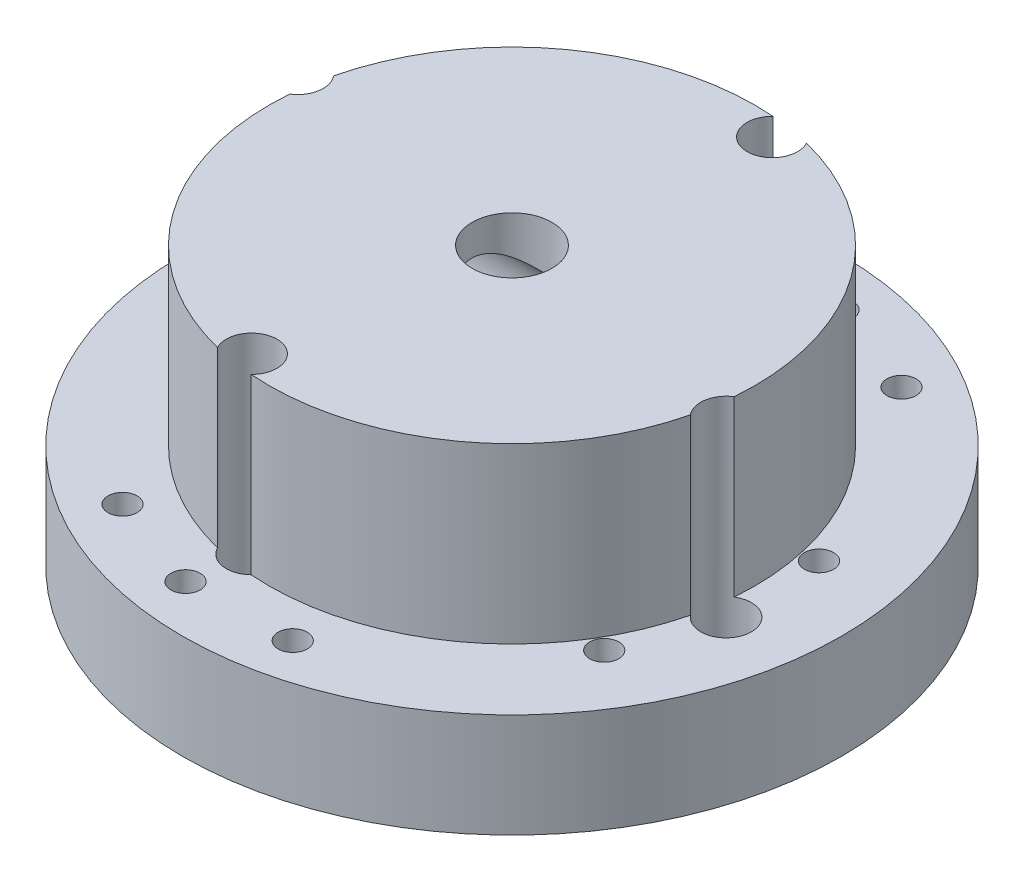
from build123d import *

# Parameters (mm, degrees)
SKETCH1_R                                         = 12.065
BOSS_EXTRUDE1_DEPTH                               = 3.81
SKETCH2_R                                         = 2.54
CUT_EXTRUDE1_DEPTH                                = 10.16
SKETCH3_R                                         = 6.35
BOSS_EXTRUDE2_DEPTH                               = 1.27
SKETCH5_R                                         = 6.35
BOSS_EXTRUDE3_DEPTH                               = 5.08
F_4_CLEARANCE_HOLE1_D                             = 2.921
F_4_CLEARANCE_HOLE1_DEPTH                         = 7.504443066
F_4_CLEARANCE_HOLE1_TIP                           = 0.877556934
BOSS_EXTRUDE4_START                               = -6.35
SKETCH11_W                                        = 12.7
SKETCH11_H                                        = 12.7
SKETCH11_R                                        = 1.4605
BOSS_EXTRUDE4_DEPTH                               = 6.35
SKETCH18_OUTSIDE_W                                = 33.252
SKETCH18_OUTSIDE_H                                = 33.252
SKETCH18_OUTSIDE_R                                = 6.35
CUT_EXTRUDE5_DEPTH                                = 6.35
SKETCH28_R                                        = 8.89
SKETCH28_R_2                                      = 6.35
BOSS_EXTRUDE5_DEPTH                               = 6.35
SKETCH27_W                                        = 2.0447
SKETCH27_H                                        = 12.065
SKETCH29_R                                        = 0.5334
CUT_EXTRUDE6_DEPTH                                = 3.81
BOSS_EXTRUDE6_START                               = 1.524
SKETCH30_R                                        = 2.54
SKETCH30_R_2                                      = 1.4605
BOSS_EXTRUDE6_DEPTH                               = 1.524
BOSS_EXTRUDE7_START                               = 1.27
SKETCH31_R                                        = 2.54
BOSS_EXTRUDE7_DEPTH                               = 1.27
SKETCH32_R                                        = 0.9144
CUT_EXTRUDE7_DEPTH                                = 20.85834968
SKETCH33_R                                        = 2.75
SKETCH33_R_2                                      = 2.54
CUT_EXTRUDE8_DEPTH                                = 1.016
CSK_FOR_0_FLAT_HEAD_MACHINE_SCREW_100_D           = 1.8542
CSK_FOR_0_FLAT_HEAD_MACHINE_SCREW_100_CSINK_D     = 3.0226
CSK_FOR_0_FLAT_HEAD_MACHINE_SCREW_100_CSINK_ANGLE = 100


with BuildPart() as part:
    # Sketch1 → Boss-Extrude1 (new body)
    with BuildSketch(Plane(origin=(0, 0, 0), x_dir=(1, 0, 0), z_dir=(0, 1, 0))):
        with Locations(Location((0, 0, 0), (0, 0, 90))):
            Circle(SKETCH1_R)
    extrude(amount=BOSS_EXTRUDE1_DEPTH)

    # Sketch2 → Cut-Extrude1 (cut)
    with BuildSketch(Plane(origin=(0, 0, 0), x_dir=(1, 0, 0), z_dir=(0, 1, 0))):
        with Locations(Location((0, 0, 0), (0, 0, 270))):
            Circle(SKETCH2_R)
    extrude(amount=CUT_EXTRUDE1_DEPTH, mode=Mode.SUBTRACT)

    # Sketch3 → Boss-Extrude2 (add)
    with BuildSketch(Plane(origin=(0, 3.81, 0), x_dir=(1, 0, 0), z_dir=(0, 1, 0))):
        with Locations(Location((0, 0, 0), (0, 0, 270))):
            Circle(SKETCH3_R)
    extrude(amount=BOSS_EXTRUDE2_DEPTH)

    # Sketch5 → Boss-Extrude3 (add)
    with BuildSketch(Plane(origin=(0, 5.08, 0), x_dir=(1, 0, 0), z_dir=(0, 1, 0))):
        with Locations(Location((0, 0, 0), (0, 0, 270))):
            Circle(SKETCH5_R)
    extrude(amount=BOSS_EXTRUDE3_DEPTH)

    # #4 Clearance Hole1
    with Locations(Plane(origin=(0, 10.16, 0), x_dir=(1, 0, 0), z_dir=(0, 1, 0))):
        with Locations((0, 0)):
            Hole(F_4_CLEARANCE_HOLE1_D / 2, depth=F_4_CLEARANCE_HOLE1_DEPTH)
            with Locations((0, 0, -(F_4_CLEARANCE_HOLE1_DEPTH + F_4_CLEARANCE_HOLE1_TIP / 2))):  # 118° drill point
                Cone(0, F_4_CLEARANCE_HOLE1_D / 2, F_4_CLEARANCE_HOLE1_TIP, mode=Mode.SUBTRACT)

    # Sketch11 → Boss-Extrude4 (add)
    with BuildSketch(Plane(origin=(0, 10.16, 0), x_dir=(1, 0, 0), z_dir=(0, 1, 0)).offset(BOSS_EXTRUDE4_START)):
        Rectangle(SKETCH11_W, SKETCH11_H)
        with Locations(Location((0, 0, 0), (0, 0, 270))):
            Circle(SKETCH11_R, mode=Mode.SUBTRACT)
    extrude(amount=BOSS_EXTRUDE4_DEPTH)

    # Sketch18 outside → Cut-Extrude5 (cut)
    with BuildSketch(Plane(origin=(0, 10.16, 0), x_dir=(1, 0, 0), z_dir=(0, 1, 0))):
        Rectangle(SKETCH18_OUTSIDE_W, SKETCH18_OUTSIDE_H)
        with Locations(Location((0, 0, 0), (0, 0, 270))):
            Circle(SKETCH18_OUTSIDE_R, mode=Mode.SUBTRACT)
    extrude(amount=-CUT_EXTRUDE5_DEPTH, mode=Mode.SUBTRACT)

    # Sketch28 → Boss-Extrude5 (add)
    with BuildSketch(Plane(origin=(0, 10.16, 0), x_dir=(1, 0, 0), z_dir=(0, 1, 0))):
        with Locations(Location((0, 0, 0), (0, 0, 270))):
            Circle(SKETCH28_R)
        Circle(SKETCH28_R_2, mode=Mode.SUBTRACT)
    extrude(amount=-BOSS_EXTRUDE5_DEPTH)

    # Sketch27 → #20 (0.161) Diameter Hole3 (revolve, cut)
    with BuildSketch(Plane(origin=(0, 6.985, 0), x_dir=(0, 0, -1), z_dir=(0, 1, 0))):
        with Locations((1.02235, 6.0325)):
            Rectangle(SKETCH27_W, SKETCH27_H)
    revolve(axis=Axis((6.35, 6.985, 0), (-1, 0, 0)), mode=Mode.SUBTRACT)

    # Sketch29 → Cut-Extrude6 (cut)
    with BuildSketch(Plane.XZ):
        with Locations(Location((9.267757815, -1.967010608, 0), (0, 0, 270))):
            Circle(SKETCH29_R)
        with Locations(Location((9.351926113, 1.517215745, 0), (0, 0, 270))):
            Circle(SKETCH29_R)
        with Locations(Location((8.170536407, 4.796123482, 0), (0, 0, 270))):
            Circle(SKETCH29_R)
        with Locations(Location((1.724727668, 8.124754034, 0), (0, 0, 270))):
            Circle(SKETCH29_R)
        with Locations(Location((2.162502581, 10.187000471, 0), (0, 0, 270))):
            Circle(SKETCH29_R)
        with Locations(Location((-1.667717039, 10.279597068, 0), (0, 0, 270))):
            Circle(SKETCH29_R)
        with Locations(Location((-1.330106029, 8.198605466, 0), (0, 0, 270))):
            Circle(SKETCH29_R)
        with Locations(Location((-5.27220716, 8.980825556, 0), (0, 0, 270))):
            Circle(SKETCH29_R)
        with Locations(Location((-4.204906686, 7.162755992, 0), (0, 0, 270))):
            Circle(SKETCH29_R)
        with Locations(Location((-8.170536407, -4.796123482, 0), (0, 0, 270))):
            Circle(SKETCH29_R)
        with Locations(Location((-9.351926113, -1.517215745, 0), (0, 0, 270))):
            Circle(SKETCH29_R)
        with Locations(Location((-9.267757815, 1.967010608, 0), (0, 0, 270))):
            Circle(SKETCH29_R)
        with Locations(Location((5.272207159, -8.980825556, 0), (0, 0, 270))):
            Circle(SKETCH29_R)
        with Locations(Location((4.204906686, -7.162755992, 0), (0, 0, 270))):
            Circle(SKETCH29_R)
        with Locations(Location((1.330106029, -8.198605466, 0), (0, 0, 270))):
            Circle(SKETCH29_R)
        with Locations(Location((1.667717039, -10.279597068, 0), (0, 0, 270))):
            Circle(SKETCH29_R)
        with Locations(Location((-2.162502581, -10.187000471, 0), (0, 0, 270))):
            Circle(SKETCH29_R)
        with Locations(Location((-1.724727668, -8.124754034, 0), (0, 0, 270))):
            Circle(SKETCH29_R)
    extrude(amount=-CUT_EXTRUDE6_DEPTH, mode=Mode.SUBTRACT)

    # Sketch30 → Boss-Extrude6 (add)
    with BuildSketch(Plane.XZ.offset(-3.81).offset(BOSS_EXTRUDE6_START)):
        with Locations(Location((0, 0, 0), (0, 0, 270))):
            Circle(SKETCH30_R)
        with Locations(Location((0, 0, 0), (0, 0, 90))):
            Circle(SKETCH30_R_2, mode=Mode.SUBTRACT)
    extrude(amount=-BOSS_EXTRUDE6_DEPTH)

    # Sketch31 → Boss-Extrude7 (add)
    with BuildSketch(Plane.XZ.offset(-2.286).offset(BOSS_EXTRUDE7_START)):
        with Locations(Location((0, 0, 0), (0, 0, 270))):
            Circle(SKETCH31_R)
    extrude(amount=-BOSS_EXTRUDE7_DEPTH)

    # Sketch32 → Cut-Extrude7 (cut, through all)
    with BuildSketch(Plane.XZ):
        with Locations(Location((-1.330106029, 8.198605466, 0), (0, 0, 270))):
            Circle(SKETCH32_R)
        with Locations(Location((9.351926113, 1.517215745, 0), (0, 0, 270))):
            Circle(SKETCH32_R)
        with Locations(Location((-9.351926113, -1.517215745, 0), (0, 0, 270))):
            Circle(SKETCH32_R)
        with Locations(Location((1.330106029, -8.198605466, 0), (0, 0, 270))):
            Circle(SKETCH32_R)
    extrude(amount=-CUT_EXTRUDE7_DEPTH, mode=Mode.SUBTRACT)

    # Sketch33 → Cut-Extrude8 (cut)
    with BuildSketch(Plane.XZ):
        with Locations(Location((0, 0, 0), (0, 0, 270))):
            Circle(SKETCH33_R)
        Circle(SKETCH33_R_2, mode=Mode.SUBTRACT)
    extrude(amount=-CUT_EXTRUDE8_DEPTH, mode=Mode.SUBTRACT)

    # CSK for #0 Flat Head Machine Screw (100)1 (through all)
    with Locations(Plane(origin=(1.330106029, 0, -8.198605466), x_dir=(0, 0, -1), z_dir=(0, -1, 0))):
        with Locations((0, 0), (-9.715821211, 8.021820084), (-16.397210932, -2.660212058), (-6.681389721, -10.682032142)):
            CounterSinkHole(CSK_FOR_0_FLAT_HEAD_MACHINE_SCREW_100_D / 2, CSK_FOR_0_FLAT_HEAD_MACHINE_SCREW_100_CSINK_D / 2, counter_sink_angle=CSK_FOR_0_FLAT_HEAD_MACHINE_SCREW_100_CSINK_ANGLE)


solid = part.part
